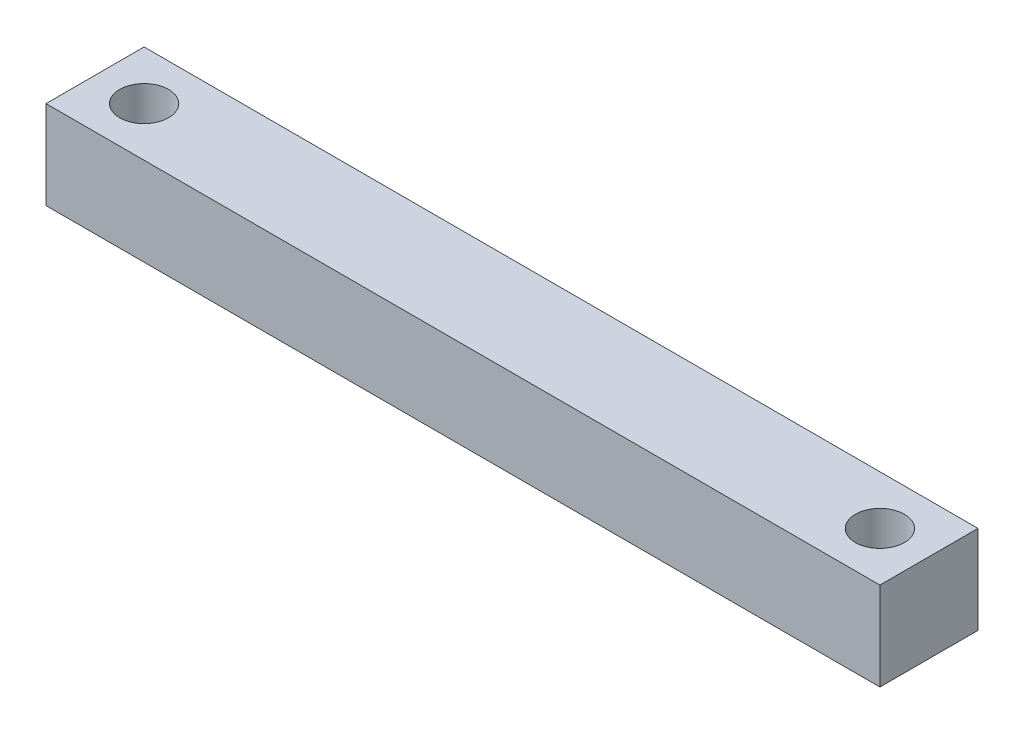
from build123d import *

# Parameters (mm, degrees)
SKETCH1_W           = 85
SKETCH1_H           = 10
BOSS_EXTRUDE1_DEPTH = 9.004889001
SKETCH2_R           = 2.5
CUT_EXTRUDE1_DEPTH  = 44.730287284


with BuildPart() as part:
    # Sketch1 → Boss-Extrude1 (new body)
    with BuildSketch(Plane(origin=(0, 0, 0), x_dir=(1, 0, 0), z_dir=(0, 1, 0))):
        Rectangle(SKETCH1_W, SKETCH1_H)
    extrude(amount=BOSS_EXTRUDE1_DEPTH)

    # Sketch2 → Cut-Extrude1 (cut, through all)
    with BuildSketch(Plane(origin=(0, 9.004889001, 0), x_dir=(1, 0, 0), z_dir=(0, 1, 0))):
        with Locations(Location((-37.5, 0, 0), (0, 0, 270))):
            Circle(SKETCH2_R)
        with Locations(Location((37.5, 0, 0), (0, 0, 270))):
            Circle(SKETCH2_R)
    extrude(amount=-CUT_EXTRUDE1_DEPTH, mode=Mode.SUBTRACT)


solid = part.part
